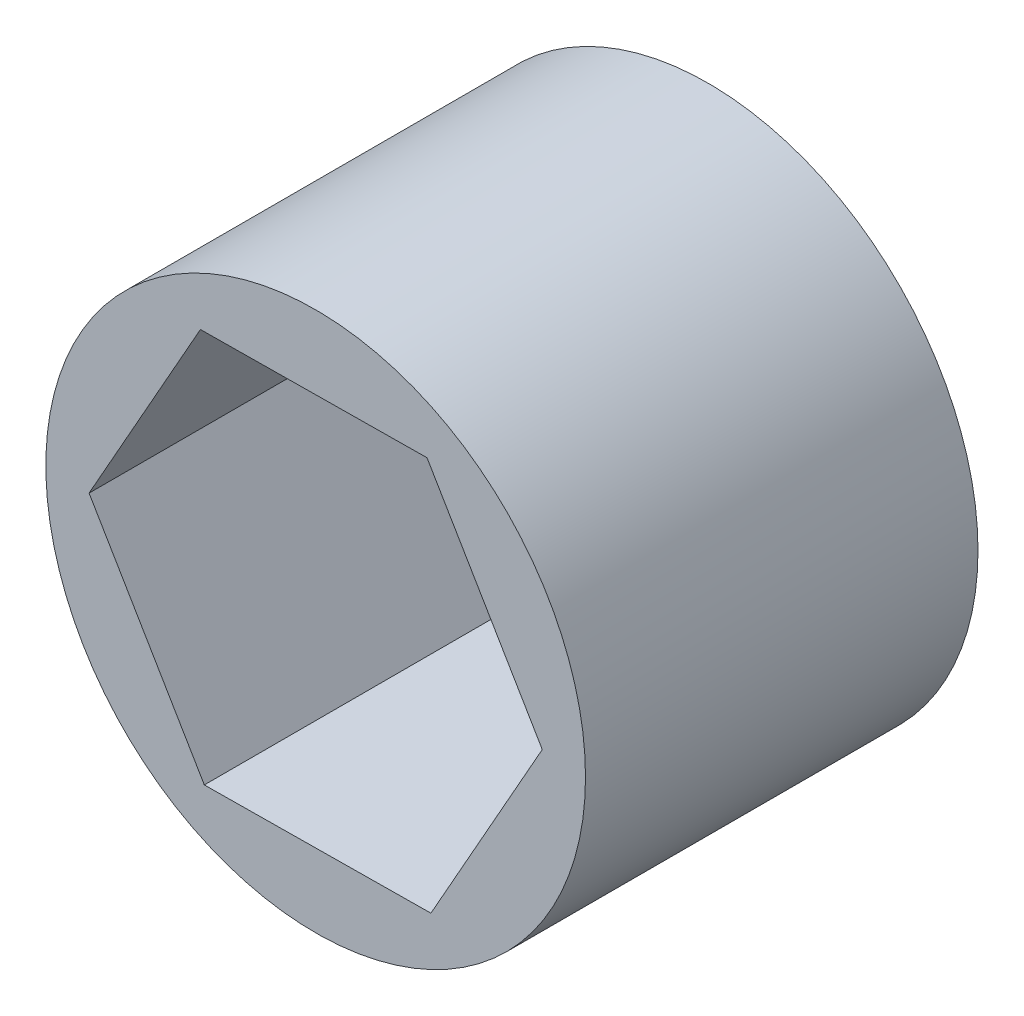
from build123d import *

# Parameters (mm, degrees)
SKETCH1_R           = 8.73125
BOSS_EXTRUDE1_DEPTH = 12.7
CUT_EXTRUDE1_DEPTH  = 18.713256424


with BuildPart() as part:
    # Sketch1 → Boss-Extrude1 (new body)
    with BuildSketch(Plane.XY):
        Circle(SKETCH1_R)
    extrude(amount=BOSS_EXTRUDE1_DEPTH)

    # Sketch2 → Cut-Extrude1 (cut, through all)
    with BuildSketch(Plane.XY.offset(12.7)):
        Polygon((3.728914853, -6.313361019), (7.331988452, 0.072654481), (3.603073599, 6.3860155), (-3.728914853, 6.313361019), (-7.331988452, -0.072654481), (-3.603073599, -6.3860155), align=None)
    extrude(amount=-CUT_EXTRUDE1_DEPTH, mode=Mode.SUBTRACT)


solid = part.part
